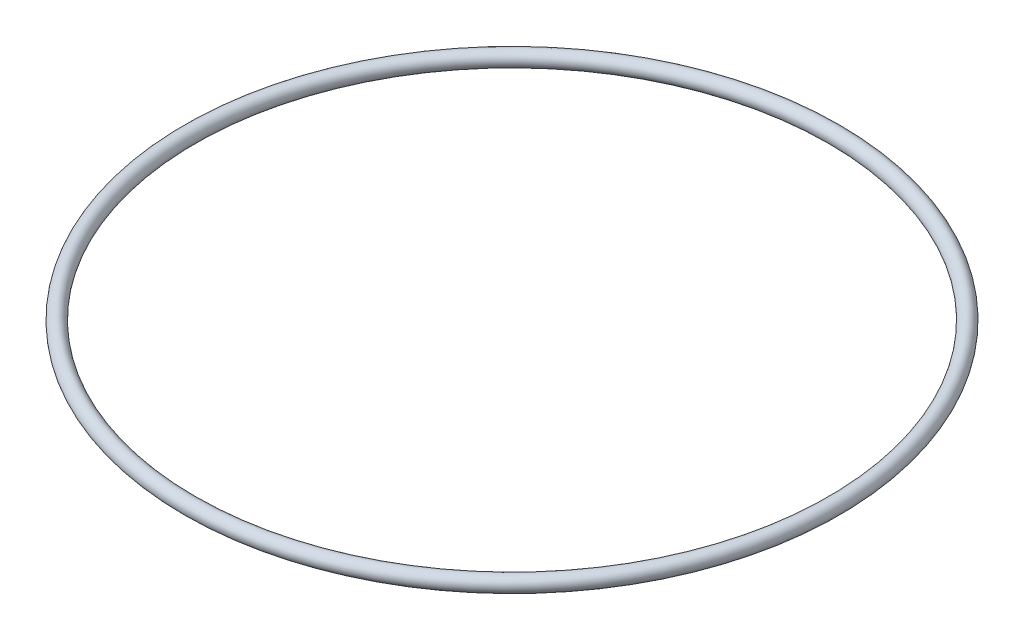
from build123d import *

# Parameters (mm, degrees)
SZKIC1_R = 1.5


with BuildPart() as part:
    # Szkic1 → Obrót1 (revolve)
    with BuildSketch(Plane.XY, mode=Mode.PRIVATE) as obr_t1_sk:
        with Locations((-63.5, 0)):
            Circle(SZKIC1_R)
    revolve(obr_t1_sk.sketch.rotate(Axis((0, 16.185657118, 0), (0, -1, 0)), 270), axis=Axis((0, 16.185657118, 0), (0, -1, 0)))


solid = part.part
